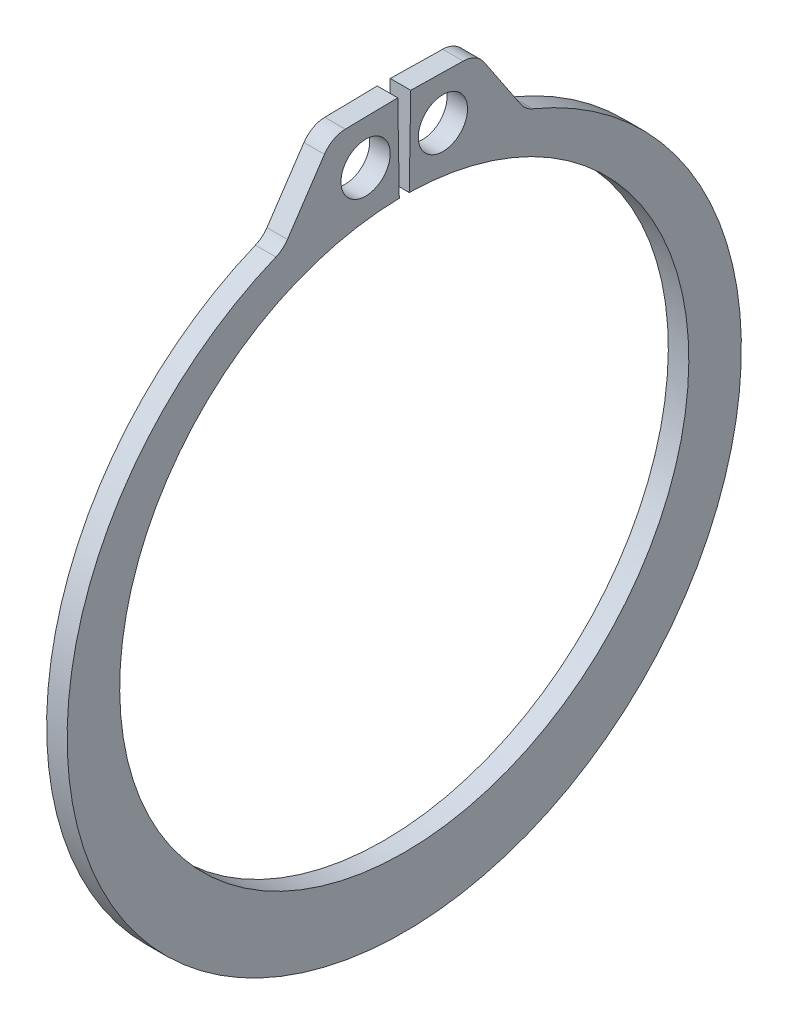
from build123d import *

# Parameters (mm, degrees)
SKETCH1_R      = 1.524
EXTRUDE1_DEPTH = 0.635
FILLET1_R      = 1.5875


with BuildPart() as part:
    # Sketch1 → Extrude1 (new, symmetric)
    with BuildSketch(Plane(origin=(0, 0, 0), x_dir=(0, 0, -1), z_dir=(1, 0, 0))):
        with BuildLine():
            Line((-0.307422394, 17.612217165), (-0.402286695, 23.046989297))
            Line((-0.402286695, 23.046989297), (-4.478365793, 22.975841072))
            Line((-4.478365793, 22.975841072), (-7.503233478, 18.459656526))
            ThreePointArc((-7.503233478, 18.459656526), (0, -21.8821), (7.503233478, 18.459656526))
            Line((7.503233478, 18.459656526), (4.478365793, 22.975841072))
            Line((4.478365793, 22.975841072), (0.402286695, 23.046989297))
            Line((0.402286695, 23.046989297), (0.307422394, 17.612217165))
            ThreePointArc((0.307422394, 17.612217165), (0, -17.6149), (-0.307422394, 17.612217165))
        make_face()
        with Locations((-2.392894094, 20.294029119)):
            Circle(SKETCH1_R, mode=Mode.SUBTRACT)
        with Locations((2.392894094, 20.294029119)):
            Circle(SKETCH1_R, mode=Mode.SUBTRACT)
    extrude(amount=EXTRUDE1_DEPTH, both=True)

    # Fillet1
    fillet1_edges = [part.edges().sort_by_distance(p)[0] for p in [
        (0, 22.975841072, -4.478365793),
        (0, 18.459656526, -7.503233478),
        (0, 18.459656526, 7.503233478),
        (0, 22.975841072, 4.478365793),
    ]]
    fillet(fillet1_edges, radius=FILLET1_R)


solid = part.part
